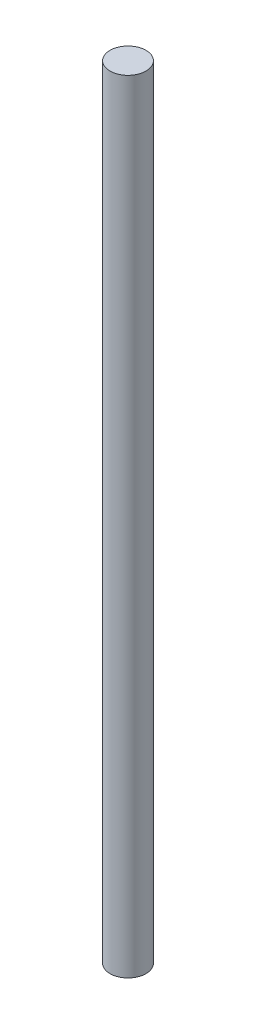
from build123d import *

# Parameters (mm, degrees)
SKETCH1_R           = 1.7526
BOSS_EXTRUDE1_DEPTH = 76.2


with BuildPart() as part:
    # Sketch1 → Boss-Extrude1 (new body)
    with BuildSketch(Plane(origin=(0, 0, 0), x_dir=(1, 0, 0), z_dir=(0, 1, 0))):
        with Locations(Location((0, 0, 0), (0, 0, 90))):
            Circle(SKETCH1_R)
    extrude(amount=BOSS_EXTRUDE1_DEPTH)


solid = part.part
